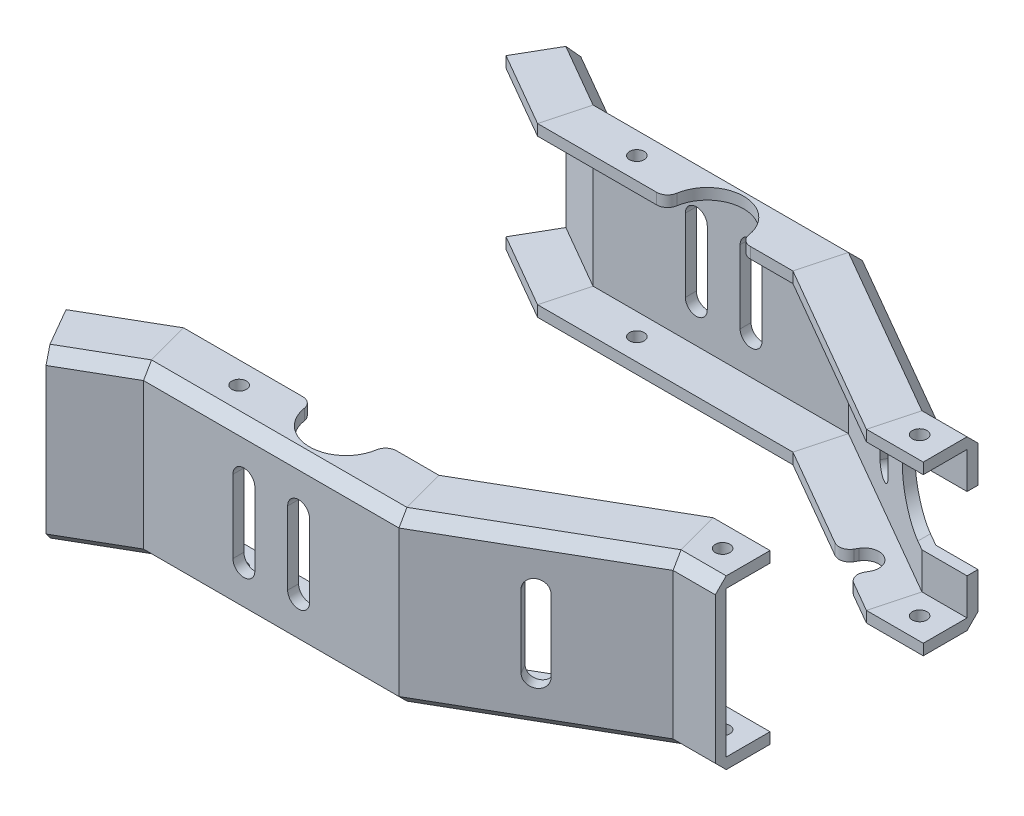
from build123d import *

# Parameters (mm, degrees)
CUT_EXTRUDE3_DEPTH      = 5
CUT_EXTRUDE4_DEPTH      = 10
CHAMFER1_SIZE           = 3
CUT_EXTRUDE6_DEPTH      = 3
F_4_0MM_DOWEL_HOLE2_D   = 4
CUT_EXTRUDE9_DEPTH      = 10
CUT_EXTRUDE7_DEPTH      = 146.985046122
CUT_EXTRUDE7_DEPTH_BACK = 5
FILLET1_R               = 3
FILLET2_R               = 3


with BuildPart() as part:
    # Sweep8: sweep along a path in Sketch6
    with BuildLine(Plane(origin=(0, 0, 0), x_dir=(1, 0, 0), z_dir=(0, 1, 0))) as sweep8_path:
        Line((-87.320508076, -10), (-70, 0))
        Line((-70, 0), (0, 0))
        Line((0, 0), (47.631397208, 27.5))
        Line((47.631397208, 27.5), (59.631397208, 27.5))
    # Sketch7 → Sweep8 (sweep)
    with BuildSketch(Plane(origin=(0, 0, 0), x_dir=(0, 0, -1), z_dir=(1, 0, 0))):
        Polygon((-1.604651163, -23), (-1.604651163, 23), (13.395348837, 23), (13.395348837, 20), (1.395348837, 20), (1.395348837, -20), (13.395348837, -20), (13.395348837, -23), align=None)
    sweep(path=sweep8_path.line, transition=Transition.RIGHT)

    # Sketch10 → Cut-Extrude3 (cut)
    with BuildSketch(Plane(origin=(0, 23, 0), x_dir=(1, 0, 0), z_dir=(0, 1, 0))):
        with BuildLine():
            Line((-38.089272903, 13.395348837), (-18.089272903, 13.395348837))
            Line((-18.089272903, 13.395348837), (-18.089272903, 12.395348837))
            ThreePointArc((-18.089272903, 12.395348837), (-28.089272903, 2.395348837), (-38.089272903, 12.395348837))
            Line((-38.089272903, 12.395348837), (-38.089272903, 13.395348837))
        make_face()
    extrude(amount=-CUT_EXTRUDE3_DEPTH, mode=Mode.SUBTRACT)

    # Sketch11 → Cut-Extrude4 (cut)
    with BuildSketch(Plane.XY.offset(1.604651163)):
        with BuildLine():
            Line((-45.070035017, -10), (-45.070035017, 10))
            ThreePointArc((-45.070035017, 10), (-42.070035017, 13), (-39.070035017, 10))
            Line((-39.070035017, 10), (-39.070035017, -10))
            ThreePointArc((-39.070035017, -10), (-42.070035017, -13), (-45.070035017, -10))
        make_face()
        with BuildLine():
            Line((-24.070035017, -10), (-24.070035017, 10))
            ThreePointArc((-24.070035017, 10), (-27.070035017, 13), (-30.070035017, 10))
            Line((-30.070035017, 10), (-30.070035017, -10))
            ThreePointArc((-30.070035017, -10), (-27.070035017, -13), (-24.070035017, -10))
        make_face()
    extrude(amount=-CUT_EXTRUDE4_DEPTH, mode=Mode.SUBTRACT)

    # Chamfer1
    chamfer1_edges = [part.edges().sort_by_distance(p)[0] for p in [
        (-78.044108756, -23, 6.497159917),
        (-34.570035017, -23, 1.604651163),
        (24.245663587, -23, -12.145348837),
        (-78.044108756, 23, 6.497159917),
        (-34.570035017, 23, 1.604651163),
        (24.245663587, 23, -12.145348837),
        (53.8463797, -23, -25.895348837),
        (53.8463797, 23, -25.895348837),
    ]]
    chamfer(chamfer1_edges, length=CHAMFER1_SIZE)

    # Sketch14 → Cut-Extrude6 (cut)
    with BuildSketch(Plane(origin=(0.802325581, 0, 1.389668671), x_dir=(0.8660254037844379, 0, -0.5000000000000014), z_dir=(0.5000000000000014, 0, 0.8660254037844379))):
        with BuildLine():
            Line((24.070035017, -10), (24.070035017, 10))
            ThreePointArc((24.070035017, 10), (27.070035017, 13), (30.070035017, 10))
            Line((30.070035017, 10), (30.070035017, -10))
            ThreePointArc((30.070035017, -10), (27.070035017, -13), (24.070035017, -10))
        make_face()
    extrude(amount=-CUT_EXTRUDE6_DEPTH, mode=Mode.SUBTRACT)

    # Ø4.0mm Dowel Hole2 (through all)
    with Locations(Plane(origin=(0, -23, 0), x_dir=(-1, 0, 0), z_dir=(0, -1, 0))):
        with Locations((52.368602792, 7.395348837), (-52.631397208, 34.895348837)):
            Hole(F_4_0MM_DOWEL_HOLE2_D / 2)

    # Sketch22 → Cut-Extrude9 (cut)
    with BuildSketch(Plane.XZ.offset(23)):
        with BuildLine():
            Line((28.288603527, -27.181247222), (26.288603527, -30.645348837))
            Line((26.288603527, -30.645348837), (33.216806758, -34.645348837))
            Line((33.216806758, -34.645348837), (35.216806758, -31.181247222))
            ThreePointArc((35.216806758, -31.181247222), (33.752705142, -25.717145607), (28.288603527, -27.181247222))
        make_face()
    extrude(amount=-CUT_EXTRUDE9_DEPTH, mode=Mode.SUBTRACT)


with BuildPart() as body_2:
    # Mirror2: mirrored copy
    add(part.part.mirror(Plane(origin=(0, 0, -61.895348837), x_dir=(1, 0, 0), z_dir=(0, 0, -1))))

    # Sketch20 → Cut-Extrude7 (cut, two sides: drawn at the far end of the back side and taken through both)
    with BuildSketch(Plane(origin=(0, 0, -97.895348837), x_dir=(-1, 0, 0), z_dir=(0, 0, -1)).offset(-CUT_EXTRUDE7_DEPTH_BACK)):
        with BuildLine():
            ThreePointArc((-44.631397208, -10), (-34.631397208, 0), (-44.631397208, 10))
            Line((-44.631397208, 10), (-59.631397208, 10))
            Line((-59.631397208, 10), (-59.631397208, -10))
            Line((-59.631397208, -10), (-44.631397208, -10))
        make_face()
    extrude(amount=CUT_EXTRUDE7_DEPTH + CUT_EXTRUDE7_DEPTH_BACK, mode=Mode.SUBTRACT)

    # Fillet2
    fillet2_edges = [body_2.edges().sort_by_distance(p)[0] for p in [
        (-38.089272903, 21.5, -110.395348837),
        (-18.089272903, 21.5, -110.395348837),
        (26.288603527, -21.5, -93.145348837),
        (33.216806758, -21.5, -89.145348837),
    ]]
    fillet(fillet2_edges, radius=FILLET2_R)


with BuildPart() as part_1:
    add(part.part)

    # Fillet1
    fillet1_edges = [part_1.edges().sort_by_distance(p)[0] for p in [
        (26.288603527, -21.5, -30.645348837),
        (33.216806758, -21.5, -34.645348837),
        (-18.089272903, 21.5, -13.395348837),
        (-38.089272903, 21.5, -13.395348837),
    ]]
    fillet(fillet1_edges, radius=FILLET1_R)


solid = Compound([body_2.part, part_1.part])
